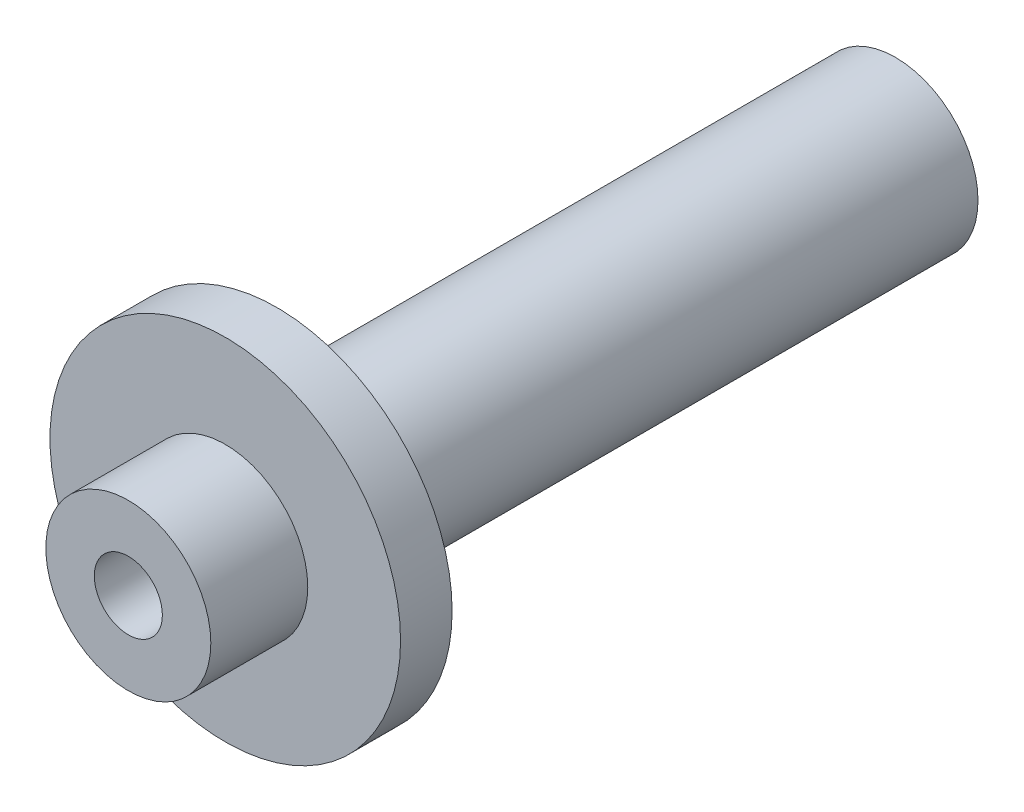
from build123d import *

# Parameters (mm, degrees)
SKETCH_1_R          = 8.5
EXTRUDE_1_DEPTH     = 2.5
SKETCH_2_R          = 4
EXTRUDE_2_DEPTH     = 4.7
SKETCH_3_R          = 1.65
CUT_EXTRUDE_1_DEPTH = 12
EXTRUDE_START       = 30
SKETCH_4_R          = 4
EXTRUDE_3_DEPTH     = 30


with BuildPart() as part:
    # Эскиз1 → Бобышка-Вытянуть1 (new body)
    with BuildSketch(Plane.XY):
        Circle(SKETCH_1_R)
    extrude(amount=EXTRUDE_1_DEPTH)

    # Эскиз2 → Бобышка-Вытянуть2 (add)
    with BuildSketch(Plane.XY.offset(2.5)):
        Circle(SKETCH_2_R)
    extrude(amount=EXTRUDE_2_DEPTH)

    # Эскиз3 → Вырез-Вытянуть1 (cut)
    with BuildSketch(Plane.XY.offset(7.2)):
        Circle(SKETCH_3_R)
    extrude(amount=-CUT_EXTRUDE_1_DEPTH, mode=Mode.SUBTRACT)

    # Эскиз4 → Бобышка-Вытянуть3 (add)
    with BuildSketch(Plane(origin=(0, 0, 0), x_dir=(-1, 0, 0), z_dir=(0, 0, -1)).offset(EXTRUDE_START)):
        with Locations(Location((0, 0, 0), (0, 0, 180))):
            Circle(SKETCH_4_R)
    extrude(amount=-EXTRUDE_3_DEPTH)


solid = part.part
